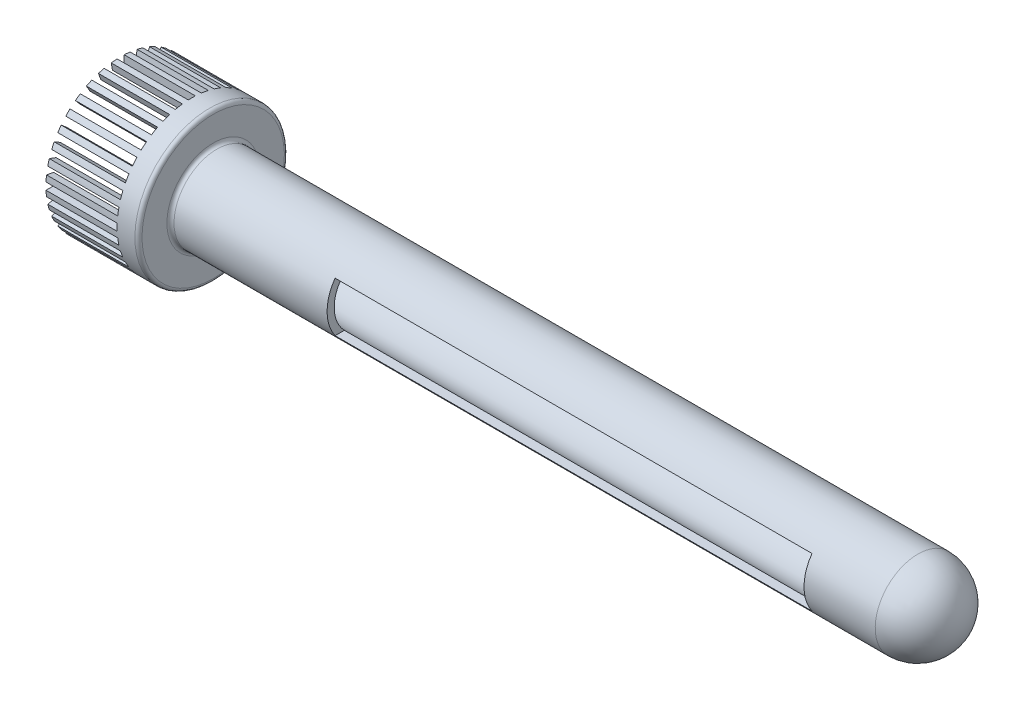
from build123d import *

# Parameters (mm, degrees)
CUT_EXTRUDE_11_DEPTH      = 64.719604762
CUT_EXTRUDE_11_DEPTH_BACK = 64.719604762
SKETCH_3_W                = 67
SKETCH_3_H                = 7
SKETCH_5_W                = 2
SKETCH_5_H                = 1
CUT_EXTRUDE_12_DEPTH      = 10
PATTERN_CIRCULAR_1_COUNT  = 36
FILLET_1_R                = 0.5
FILLET_2_R                = 0.5
FILLET_3_R                = 0.5
FILLET_4_R                = 0.5


with BuildPart() as part:
    # 草图1 → 旋转1 (revolve)
    with BuildSketch(Plane.XY, mode=Mode.PRIVATE) as revolve_1_sk:
        with BuildLine():
            Line((-49.9652163, 5), (50.0347837, 5))
            ThreePointArc((50.0347837, 5), (53.547751343, 3.523246671), (54.999900891, 3.7375e-05))
            Line((54.999900891, 3.7375e-05), (55.999900891, 3.7375e-05))
            ThreePointArc((55.999900891, 3.7375e-05), (54.256038095, 4.22917348), (50.038121182, 6))
            Line((50.038121182, 6), (-48.9652163, 6))
            Line((-48.9652163, 6), (-48.9652163, 10.5))
            Line((-48.9652163, 10.5), (-61.9652163, 10.5))
            Line((-61.9652163, 10.5), (-61.9652163, 9.5))
            Line((-61.9652163, 9.5), (-49.9652163, 9.5))
            Line((-49.9652163, 9.5), (-49.9652163, 5))
        make_face()
    revolve(revolve_1_sk.sketch.rotate(Axis((0, 0, 0), (1, 0, 0)), 180), axis=Axis((0, 0, 0), (1, 0, 0)))

    # 草图3 → 切除-拉伸11 (cut, two sides: drawn at the far end of the back side and taken through both)
    with BuildSketch(Plane.XY.offset(-CUT_EXTRUDE_11_DEPTH_BACK)):
        with Locations((6.5347837, 3.7375e-05)):
            Rectangle(SKETCH_3_W, SKETCH_3_H)
    extrude(amount=CUT_EXTRUDE_11_DEPTH + CUT_EXTRUDE_11_DEPTH_BACK, mode=Mode.SUBTRACT)

    # 草图5 → 切除-拉伸12 (cut)
    with BuildSketch(Plane.ZY.offset(61.9652163)):
        with Locations((-10, 0)):
            Rectangle(SKETCH_5_W, SKETCH_5_H)
    cut_extrude_12 = extrude(amount=-CUT_EXTRUDE_12_DEPTH, mode=Mode.SUBTRACT)

    # 阵列(圆周)1: 切除-拉伸12 ×36 about axis
    pattern_circular_1_axis = Axis((0, 0, 0), (1, 0, 0))
    for i in range(1, PATTERN_CIRCULAR_1_COUNT):
        add(cut_extrude_12.rotate(pattern_circular_1_axis, i * 360 / PATTERN_CIRCULAR_1_COUNT), mode=Mode.SUBTRACT)

    # 圆角1
    fillet_1_edges = [part.edges().sort_by_distance(p)[0] for p in [
        (-49.9652163, 5, 0),
    ]]
    fillet(fillet_1_edges, radius=FILLET_1_R)

    # 圆角2
    fillet_2_edges = [part.edges().sort_by_distance(p)[0] for p in [
        (-49.9652163, 9.5, 0),
    ]]
    fillet(fillet_2_edges, radius=FILLET_2_R)

    # 圆角3
    fillet_3_edges = [part.edges().sort_by_distance(p)[0] for p in [
        (-48.9652163, 10.5, 0),
    ]]
    fillet(fillet_3_edges, radius=FILLET_3_R)

    # 圆角4
    fillet_4_edges = [part.edges().sort_by_distance(p)[0] for p in [
        (-48.9652163, 6, 0),
    ]]
    fillet(fillet_4_edges, radius=FILLET_4_R)


solid = part.part
